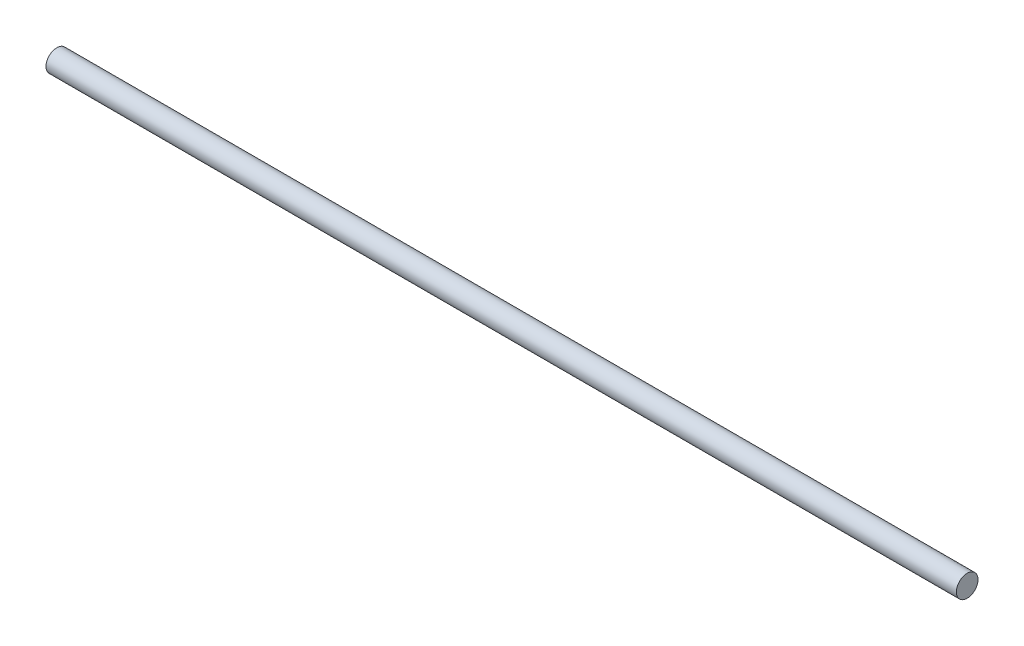
from build123d import *

# Parameters (mm, degrees)
SKETCH1_R           = 2.286
BOSS_EXTRUDE1_DEPTH = 191.750877523


with BuildPart() as part:
    # Sketch1 → Boss-Extrude1 (new body)
    with BuildSketch(Plane(origin=(0, 0, 0), x_dir=(0, 0, -1), z_dir=(1, 0, 0))):
        with Locations(Location((0, 0, 0), (0, 0, 180))):
            Circle(SKETCH1_R)
    extrude(amount=BOSS_EXTRUDE1_DEPTH)


solid = part.part
